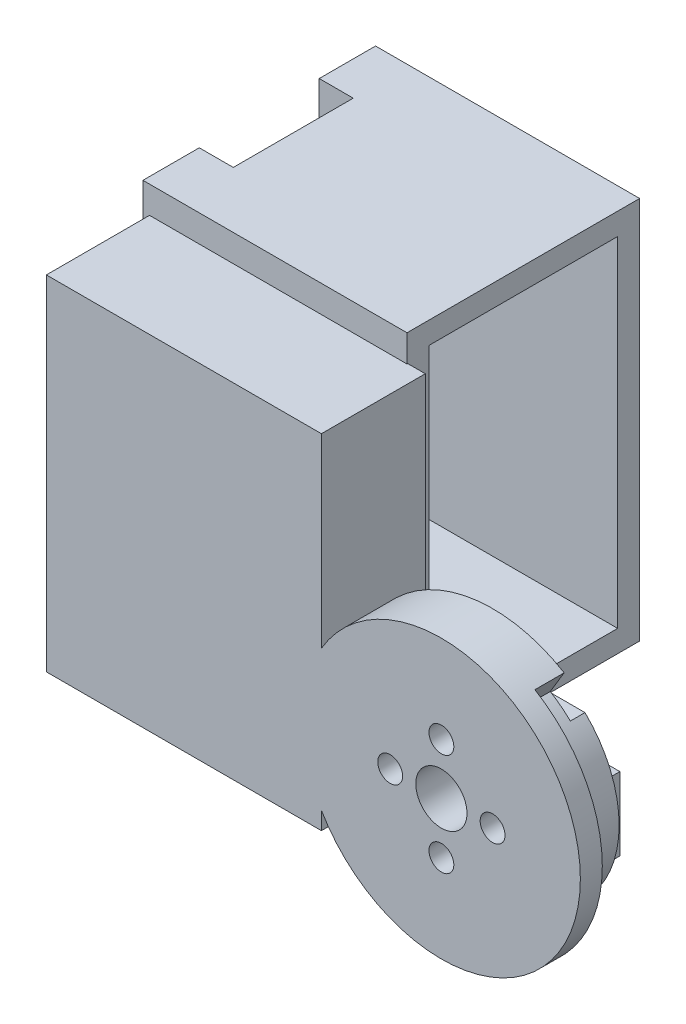
from build123d import *
from build123d.topology import SkipClean

# Parameters (mm, degrees)
S_CYL1_R        = 19
BOSS_1_DEPTH    = 7
BOSS_2_DEPTH    = 2.1
S_BOX3_W        = 28.2
S_BOX3_H        = 10
BOSS_3_DEPTH    = 1.5
S_BOX4_W        = 37.6
S_BOX4_H        = 47
BOSS_4_DEPTH    = 14.2
S_BOX5_W        = 36.1
S_BOX5_H        = 3
BOSS_5_DEPTH    = 31.8
S_BOX6_W        = 36.1
S_BOX6_H        = 3
BOSS_6_DEPTH    = 31.8
S_BOX7_W        = 36.1
S_BOX7_H        = 52.4
BOSS_7_DEPTH    = 3
S_BOX8_W        = 36.1
S_BOX8_H        = 52.4
BOSS_8_DEPTH    = 3
S_BOX9_W        = 4.6
S_BOX9_H        = 52.4
BOSS_9_DEPTH    = 31.8
S_HOLE10_R      = 10.5
HOLE_10_DEPTH   = 4.8
S_CUT11_W       = 4.75
S_CUT11_H       = 19.5
POCKET_11_DEPTH = 19.4
S_CUT12_W       = 4.75
S_CUT12_H       = 8.8
POCKET_12_DEPTH = 16.4
S_CUT13_W       = 4.75
S_CUT13_H       = 11
POCKET_13_DEPTH = 7
S_CUT14_W       = 2.9
S_CUT14_H       = 20
POCKET_14_DEPTH = 16.4
S_HOLE15_R      = 1.1
HOLE_15_DEPTH   = 4.8
S_HOLE16_R      = 2.3
HOLE_16_DEPTH   = 1.7
S_HOLE17_R      = 1.1
HOLE_17_DEPTH   = 4.8
S_HOLE18_R      = 2.3
HOLE_18_DEPTH   = 1.7
S_HOLE19_R      = 1.1
HOLE_19_DEPTH   = 4.8
S_HOLE20_R      = 2.3
HOLE_20_DEPTH   = 1.7
CUT_21_DEPTH    = 6.1
S_HOLE22_R      = 3.5
HOLE_22_DEPTH   = 10.6
S_HOLE23_R      = 1.7
HOLE_23_DEPTH   = 10.6
S_HOLE24_R      = 1.7
HOLE_24_DEPTH   = 10.6
S_HOLE25_R      = 1.7
HOLE_25_DEPTH   = 10.6
S_HOLE26_R      = 1.7
HOLE_26_DEPTH   = 10.6
S_HOLE27_R      = 3.2
HOLE_27_DEPTH   = 7.6
S_HOLE28_R      = 3.2
HOLE_28_DEPTH   = 7.6
S_HOLE29_R      = 3.2
HOLE_29_DEPTH   = 7.6
S_HOLE30_R      = 3.2
HOLE_30_DEPTH   = 7.6


with BuildPart() as part:
    # S_cyl1 → Boss_1 (new body)
    with BuildSketch(Plane.XY.offset(23)):
        Circle(S_CYL1_R)
    extrude(amount=BOSS_1_DEPTH)

    # S_prism2 → Boss_2 (add)
    with SkipClean():  # the faces are left unmerged after this step: merging them gives an invalid solid
        with BuildSketch(Plane.XY.offset(21)):
            with BuildLine():
                Line((-15.491933385, 11), (15.491933385, 11))
                ThreePointArc((15.491933385, 11), (19, 0), (15.491933385, -11))
                Line((15.491933385, -11), (-15.491933385, -11))
                ThreePointArc((-15.491933385, -11), (-19, 0), (-15.491933385, 11))
            make_face()
        extrude(amount=BOSS_2_DEPTH)

    # S_box3 → Boss_3 (add)
    with SkipClean():  # the faces are left unmerged after this step: merging them gives an invalid solid
        with BuildSketch(Plane.XY.offset(19.6)):
            with Locations((-0.1, 0)):
                Rectangle(S_BOX3_W, S_BOX3_H)
        extrude(amount=BOSS_3_DEPTH)

    # S_box4 → Boss_4 (add)
    with SkipClean():  # the faces are left unmerged after this step: merging them gives an invalid solid
        with BuildSketch(Plane.XY.offset(15.8)):
            with Locations((-35.2, 11.5)):
                Rectangle(S_BOX4_W, S_BOX4_H)
        extrude(amount=BOSS_4_DEPTH)

    # S_box6 → Boss_6 (add)
    with SkipClean():  # the faces are left unmerged after this step: merging them gives an invalid solid
        with BuildSketch(Plane.XY.offset(-15.9)):
            with Locations((-36.85, -12.2)):
                Rectangle(S_BOX6_W, S_BOX6_H)
        extrude(amount=BOSS_6_DEPTH)



with BuildPart() as body_2:
    # S_box5 → Boss_5 (new body)
    with BuildSketch(Plane.XY.offset(-15.9)):
        with Locations((-36.85, 37.2)):
            Rectangle(S_BOX5_W, S_BOX5_H)
    extrude(amount=BOSS_5_DEPTH)


with BuildPart() as part_1:
    with SkipClean():  # the faces are left unmerged after this step: merging them gives an invalid solid
        add(part.part)

        add(body_2.part)  # Boss_7 merges body 2
        # S_box7 → Boss_7 (add)
        with BuildSketch(Plane.XY.offset(-15.9)):
            with Locations((-36.85, 12.5)):
                Rectangle(S_BOX7_W, S_BOX7_H)
        extrude(amount=BOSS_7_DEPTH)

    # S_box8 → Boss_8 (add)
    with SkipClean():  # the faces are left unmerged after this step: merging them gives an invalid solid
        with BuildSketch(Plane.XY.offset(12.9)):
            with Locations((-36.85, 12.5)):
                Rectangle(S_BOX8_W, S_BOX8_H)
        extrude(amount=BOSS_8_DEPTH)

    # S_box9 → Boss_9 (add)
    with SkipClean():  # the faces are left unmerged after this step: merging them gives an invalid solid
        with BuildSketch(Plane.XY.offset(-15.9)):
            with Locations((-52.6, 12.5)):
                Rectangle(S_BOX9_W, S_BOX9_H)
        extrude(amount=BOSS_9_DEPTH)

    # S_hole10 → Hole_10 (cut)
    with SkipClean():  # the faces are left unmerged after this step: merging them gives an invalid solid
        with BuildSketch(Plane(origin=(-55, 0, 0), x_dir=(0, 0, -1), z_dir=(1, 0, 0))):
            Circle(S_HOLE10_R)
        extrude(amount=HOLE_10_DEPTH, mode=Mode.SUBTRACT)

    # S_cut11 → Pocket_11 (cut)
    with SkipClean():  # the faces are left unmerged after this step: merging them gives an invalid solid
        with BuildSketch(Plane.XY.offset(-9.7)):
            with Locations((-52.625, 20.65)):
                Rectangle(S_CUT11_W, S_CUT11_H)
        extrude(amount=POCKET_11_DEPTH, mode=Mode.SUBTRACT)

    # S_cut12 → Pocket_12 (cut)
    with SkipClean():  # the faces are left unmerged after this step: merging them gives an invalid solid
        with BuildSketch(Plane.XY.offset(-8.2)):
            with Locations((-52.625, 34.8)):
                Rectangle(S_CUT12_W, S_CUT12_H)
        extrude(amount=POCKET_12_DEPTH, mode=Mode.SUBTRACT)

    # S_cut13 → Pocket_13 (cut)
    with SkipClean():  # the faces are left unmerged after this step: merging them gives an invalid solid
        with BuildSketch(Plane.XY.offset(-3.5)):
            with Locations((-52.625, 5.5)):
                Rectangle(S_CUT13_W, S_CUT13_H)
        extrude(amount=POCKET_13_DEPTH, mode=Mode.SUBTRACT)

    # S_cut14 → Pocket_14 (cut)
    with SkipClean():  # the faces are left unmerged after this step: merging them gives an invalid solid
        with BuildSketch(Plane.XY.offset(-16.4)):
            with Locations((-53.65, 0)):
                Rectangle(S_CUT14_W, S_CUT14_H)
        extrude(amount=POCKET_14_DEPTH, mode=Mode.SUBTRACT)

    # S_hole15 → Hole_15 (cut)
    with SkipClean():  # the faces are left unmerged after this step: merging them gives an invalid solid
        with BuildSketch(Plane(origin=(-55, 0, 0), x_dir=(0, 0, -1), z_dir=(1, 0, 0))):
            with Locations((-10.25, 8.3)):
                Circle(S_HOLE15_R)
        extrude(amount=HOLE_15_DEPTH, mode=Mode.SUBTRACT)

    # S_hole16 → Hole_16 (cut)
    with SkipClean():  # the faces are left unmerged after this step: merging them gives an invalid solid
        with BuildSketch(Plane(origin=(-55, 0, 0), x_dir=(0, 0, -1), z_dir=(1, 0, 0))):
            with Locations((-10.25, 8.3)):
                Circle(S_HOLE16_R)
        extrude(amount=HOLE_16_DEPTH, mode=Mode.SUBTRACT)

    # S_hole17 → Hole_17 (cut)
    with SkipClean():  # the faces are left unmerged after this step: merging them gives an invalid solid
        with BuildSketch(Plane(origin=(-55, 0, 0), x_dir=(0, 0, -1), z_dir=(1, 0, 0))):
            with Locations((10.25, 32.75)):
                Circle(S_HOLE17_R)
        extrude(amount=HOLE_17_DEPTH, mode=Mode.SUBTRACT)

    # S_hole18 → Hole_18 (cut)
    with SkipClean():  # the faces are left unmerged after this step: merging them gives an invalid solid
        with BuildSketch(Plane(origin=(-55, 0, 0), x_dir=(0, 0, -1), z_dir=(1, 0, 0))):
            with Locations((10.25, 32.75)):
                Circle(S_HOLE18_R)
        extrude(amount=HOLE_18_DEPTH, mode=Mode.SUBTRACT)

    # S_hole19 → Hole_19 (cut)
    with SkipClean():  # the faces are left unmerged after this step: merging them gives an invalid solid
        with BuildSketch(Plane(origin=(-55, 0, 0), x_dir=(0, 0, -1), z_dir=(1, 0, 0))):
            with Locations((-10.25, 32.75)):
                Circle(S_HOLE19_R)
        extrude(amount=HOLE_19_DEPTH, mode=Mode.SUBTRACT)

    # S_hole20 → Hole_20 (cut)
    with SkipClean():  # the faces are left unmerged after this step: merging them gives an invalid solid
        with BuildSketch(Plane(origin=(-55, 0, 0), x_dir=(0, 0, -1), z_dir=(1, 0, 0))):
            with Locations((-10.25, 32.75)):
                Circle(S_HOLE20_R)
        extrude(amount=HOLE_20_DEPTH, mode=Mode.SUBTRACT)

    # S_pcut21 → Cut_21 (cut)
    with BuildSketch(Plane.XY.offset(20.9)):
        with BuildLine():
            Line((-9.201642631, -17.30577282), (-7.182914911, -13.509098171))
            ThreePointArc((-7.182914911, -13.509098171), (13.316442148, -7.53408047), (7.880082546, 13.114659701))
            Line((7.880082546, 13.114659701), (10.094746268, 16.800479094))
            ThreePointArc((10.094746268, 16.800479094), (17.05897164, -9.651501778), (-9.201642631, -17.30577282))
        make_face()
    extrude(amount=CUT_21_DEPTH, mode=Mode.SUBTRACT)

    # S_hole22 → Hole_22 (cut)
    with BuildSketch(Plane.XY.offset(19.5)):
        Circle(S_HOLE22_R)
    extrude(amount=HOLE_22_DEPTH, mode=Mode.SUBTRACT)

    # S_hole23 → Hole_23 (cut)
    with BuildSketch(Plane.XY.offset(19.5)):
        with Locations((7, 0)):
            Circle(S_HOLE23_R)
    extrude(amount=HOLE_23_DEPTH, mode=Mode.SUBTRACT)

    # S_hole24 → Hole_24 (cut)
    with BuildSketch(Plane.XY.offset(19.5)):
        with Locations((0, -7)):
            Circle(S_HOLE24_R)
    extrude(amount=HOLE_24_DEPTH, mode=Mode.SUBTRACT)

    # S_hole25 → Hole_25 (cut)
    with BuildSketch(Plane.XY.offset(19.5)):
        with Locations((-7, 0)):
            Circle(S_HOLE25_R)
    extrude(amount=HOLE_25_DEPTH, mode=Mode.SUBTRACT)

    # S_hole26 → Hole_26 (cut)
    with BuildSketch(Plane.XY.offset(19.5)):
        with Locations((0, 7)):
            Circle(S_HOLE26_R)
    extrude(amount=HOLE_26_DEPTH, mode=Mode.SUBTRACT)

    # S_hole27 → Hole_27 (cut)
    with BuildSketch(Plane.XY.offset(19.4)):
        with Locations((7, 0)):
            Circle(S_HOLE27_R)
    extrude(amount=HOLE_27_DEPTH, mode=Mode.SUBTRACT)

    # S_hole28 → Hole_28 (cut)
    with BuildSketch(Plane.XY.offset(19.4)):
        with Locations((0, -7)):
            Circle(S_HOLE28_R)
    extrude(amount=HOLE_28_DEPTH, mode=Mode.SUBTRACT)

    # S_hole29 → Hole_29 (cut)
    with BuildSketch(Plane.XY.offset(19.4)):
        with Locations((-7, 0)):
            Circle(S_HOLE29_R)
    extrude(amount=HOLE_29_DEPTH, mode=Mode.SUBTRACT)

    # S_hole30 → Hole_30 (cut)
    with BuildSketch(Plane.XY.offset(19.4)):
        with Locations((0, 7)):
            Circle(S_HOLE30_R)
    extrude(amount=HOLE_30_DEPTH, mode=Mode.SUBTRACT)


solid = part_1.part
